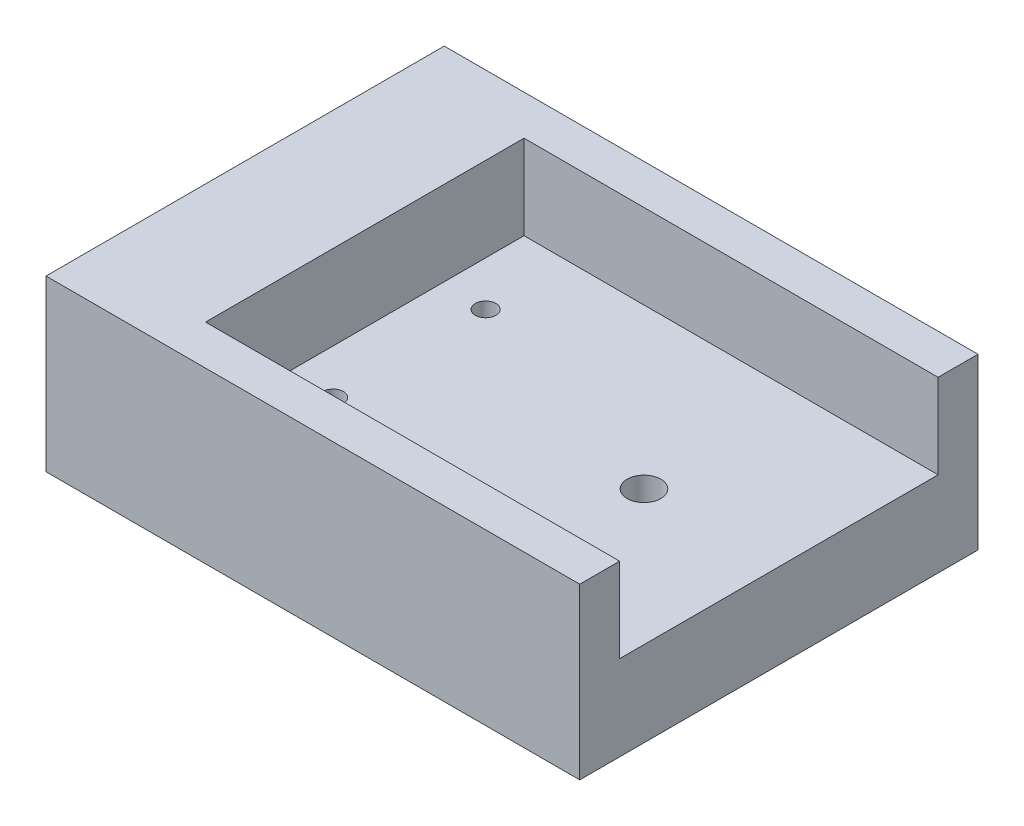
from build123d import *

# Parameters (mm, degrees)
SKETCH1_W           = 91
SKETCH1_H           = 67.9
BOSS_EXTRUDE1_DEPTH = 28.9
SKETCH2_W           = 70.6
SKETCH2_H           = 54.3
CUT_EXTRUDE1_DEPTH  = 14.4
SKETCH3_R           = 3.75
CUT_EXTRUDE2_DEPTH  = 5
SKETCH4_R           = 2.871512345
SKETCH4_R_2         = 1.754658852
CUT_EXTRUDE3_DEPTH  = 14.5


with BuildPart() as part:
    # Sketch1 → Boss-Extrude1 (new body)
    with BuildSketch(Plane(origin=(0, 0, 0), x_dir=(1, 0, 0), z_dir=(0, 1, 0))):
        Rectangle(SKETCH1_W, SKETCH1_H)
    extrude(amount=BOSS_EXTRUDE1_DEPTH)

    # Sketch2 → Cut-Extrude1 (cut)
    with BuildSketch(Plane(origin=(0, 28.9, 0), x_dir=(1, 0, 0), z_dir=(0, 1, 0))):
        with Locations((10.2, 0)):
            Rectangle(SKETCH2_W, SKETCH2_H)
    extrude(amount=-CUT_EXTRUDE1_DEPTH, mode=Mode.SUBTRACT)

    # Sketch3 → Cut-Extrude2 (cut)
    with BuildSketch(Plane.ZY.offset(45.5)):
        with Locations((0, 5.750396788)):
            Circle(SKETCH3_R)
    extrude(amount=-CUT_EXTRUDE2_DEPTH, mode=Mode.SUBTRACT)

    # Sketch4 → Cut-Extrude3 (cut)
    with BuildSketch(Plane(origin=(0, 14.5, 0), x_dir=(1, 0, 0), z_dir=(0, 1, 0))):
        with Locations(Location((22.5, 0, 0), (0, 0, 270))):
            Circle(SKETCH4_R)
        with Locations(Location((-17.5, 13, 0), (0, 0, 270))):
            Circle(SKETCH4_R_2)
        with Locations(Location((-17.5, -13, 0), (0, 0, 270))):
            Circle(SKETCH4_R_2)
    extrude(amount=-CUT_EXTRUDE3_DEPTH, mode=Mode.SUBTRACT)


solid = part.part
